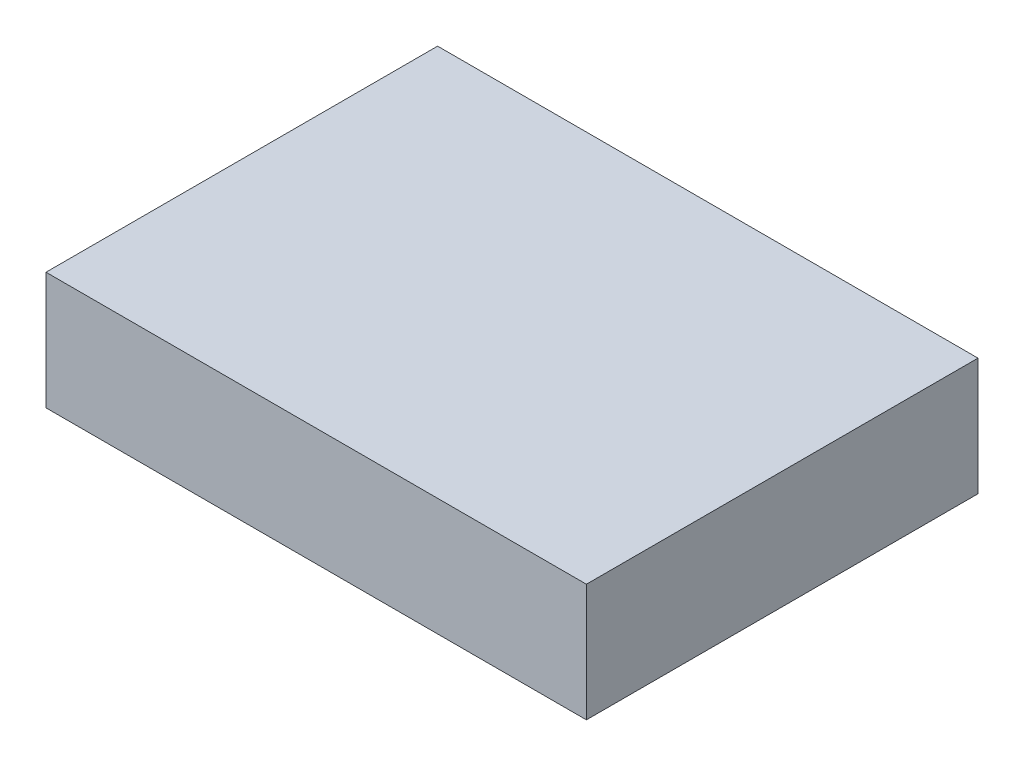
from build123d import *

# Parameters (mm, degrees)
SKETCH_1_W      = 69
SKETCH_1_H      = 50
EXTRUDE_1_DEPTH = 15


with BuildPart() as part:
    # 草图1 → 凸台-拉伸1 (new body)
    with BuildSketch(Plane(origin=(0, 0, 0), x_dir=(1, 0, 0), z_dir=(0, 1, 0))):
        Rectangle(SKETCH_1_W, SKETCH_1_H)
    extrude(amount=EXTRUDE_1_DEPTH)


solid = part.part
